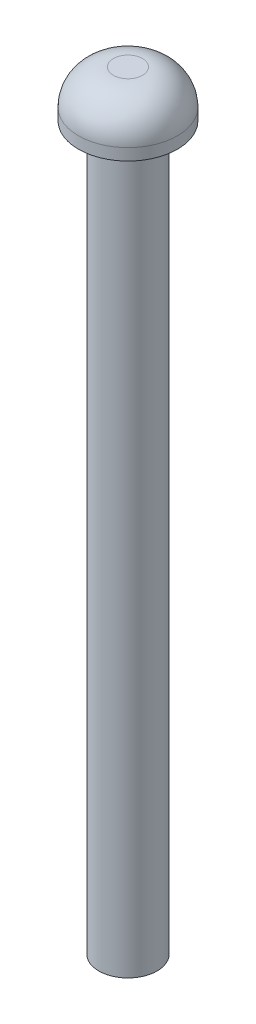
from build123d import *

# Parameters (mm, degrees)
CROQUIS1_R              = 2.5
SALIENTE_EXTRUIR1_DEPTH = 62
CROQUIS2_R              = 4.25
SALIENTE_EXTRUIR2_DEPTH = 4
REDONDEO1_R             = 3


with BuildPart() as part:
    # Croquis1 → Saliente-Extruir1 (new body)
    with BuildSketch(Plane(origin=(0, 0, 0), x_dir=(1, 0, 0), z_dir=(0, 1, 0))):
        with Locations(Location((0, 0, 0), (0, 0, 270))):
            Circle(CROQUIS1_R)
    extrude(amount=SALIENTE_EXTRUIR1_DEPTH)

    # Croquis2 → Saliente-Extruir2 (add)
    with BuildSketch(Plane(origin=(0, 62, 0), x_dir=(1, 0, 0), z_dir=(0, 1, 0))):
        with Locations(Location((0, 0, 0), (0, 0, 270))):
            Circle(CROQUIS2_R)
    extrude(amount=SALIENTE_EXTRUIR2_DEPTH)

    # Redondeo1
    redondeo1_edges = [part.edges().sort_by_distance(p)[0] for p in [
        (0, 66, -4.25),
    ]]
    fillet(redondeo1_edges, radius=REDONDEO1_R)


solid = part.part
